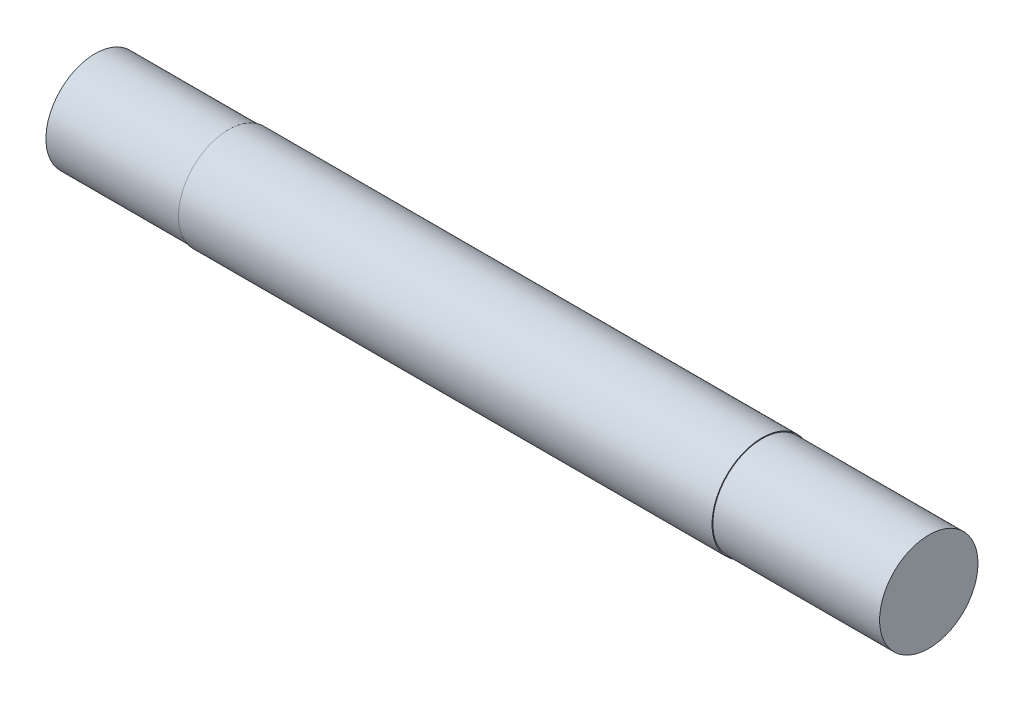
from build123d import *


with BuildPart() as part:
    # Sketch1 → Revolve1 (revolve)
    with BuildSketch(Plane(origin=(0, 0, 0), x_dir=(1, 0, 0), z_dir=(0, 1, 0))):
        Polygon((0, 0), (8, 0), (40, 0), (50, 0), (50, 2.95), (40, 2.95), (40, 3), (8, 3), (8, 2.95), (0, 2.95), align=None)
    revolve(axis=Axis((0, 0, 0), (-1, 0, 0)))


solid = part.part
